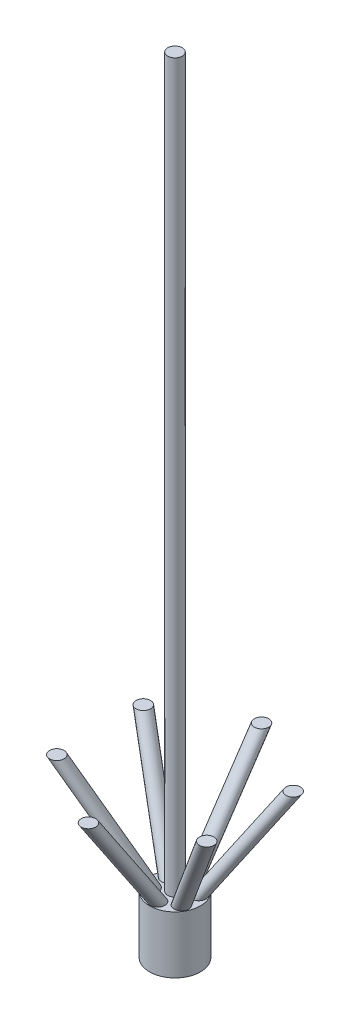
from build123d import *

# Parameters (mm, degrees)
SKETCH1_R           = 0.4445
BOSS_EXTRUDE1_DEPTH = 1
SKETCH2_R           = 0.127
BOSS_EXTRUDE2_DEPTH = 12.7
SKETCH3_R           = 0.127
CIRPATTERN1_COUNT   = 6


with BuildPart() as part:
    # Sketch1 → Boss-Extrude1 (new body)
    with BuildSketch(Plane(origin=(0, 0, 0), x_dir=(1, 0, 0), z_dir=(0, 1, 0))):
        with Locations(Location((0, 0, 0), (0, 0, 270))):
            Circle(SKETCH1_R)
    extrude(amount=BOSS_EXTRUDE1_DEPTH)

    # Sketch2 → Boss-Extrude2 (add)
    with BuildSketch(Plane(origin=(0, 1, 0), x_dir=(1, 0, 0), z_dir=(0, 1, 0))):
        with Locations(Location((0, 0, 0), (0, 0, 270))):
            Circle(SKETCH2_R)
    extrude(amount=BOSS_EXTRUDE2_DEPTH)

    # Sweep2: sweep along a curve in space
    with BuildLine() as sweep2_path:
        Line((0, 1, -0.3048), (0, 2.789892119, -1.512097479))
    # Sketch3 → Sweep2 (sweep)
    with BuildSketch(Plane(origin=(0, 1, 0), x_dir=(1, 0, 0), z_dir=(0, 1, 0))):
        with Locations((0, 0.3048)):
            Circle(SKETCH3_R)
    sweep2 = sweep(path=sweep2_path.line)

    # CirPattern1: Sweep2 ×6 about axis
    cirpattern1_axis = Axis((0, 1, 0), (0, 1, 0))
    for i in range(1, CIRPATTERN1_COUNT):
        add(sweep2.rotate(cirpattern1_axis, i * 360 / CIRPATTERN1_COUNT))


solid = part.part
